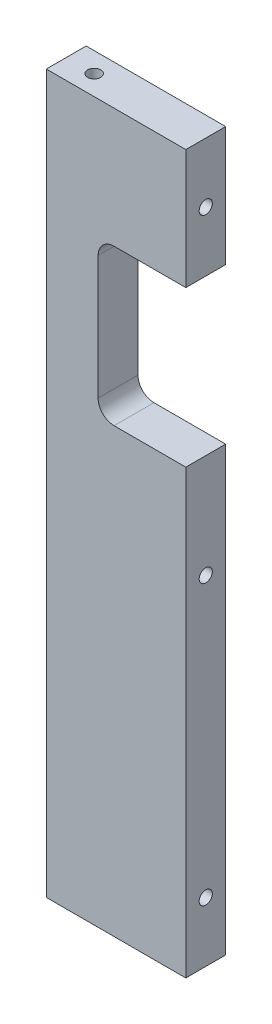
from build123d import *

# Parameters (mm, degrees)
SKETCH_1_W          = 35
SKETCH_1_H          = 180
EXTRUDE_1_DEPTH     = 10
SKETCH_2_W          = 22
SKETCH_2_H          = 39
CUT_EXTRUDE_1_DEPTH = 39
FILLET_1_R          = 4
SKETCH_3_R          = 1.65
CUT_EXTRUDE_2_DEPTH = 15
SKETCH_5_R          = 1.65
CUT_EXTRUDE_3_DEPTH = 15
SKETCH_6_R          = 1.139472941
SKETCH_6_R_2        = 1.207913295
CUT_EXTRUDE_4_DEPTH = 12
SKETCH_7_R          = 1.65
CUT_EXTRUDE_5_DEPTH = 12


with BuildPart() as part:
    # Эскиз1 → Бобышка-Вытянуть1 (new body)
    with BuildSketch(Plane.XY):
        with Locations((-10.704653715, -21.244958968)):
            Rectangle(SKETCH_1_W, SKETCH_1_H)
    extrude(amount=EXTRUDE_1_DEPTH)

    # Эскиз2 → Вырез-Вытянуть1 (cut)
    with BuildSketch(Plane(origin=(0, 0, 0), x_dir=(-1, 0, 0), z_dir=(0, 0, -1))):
        with Locations((4.204653715, 19.255041032)):
            Rectangle(SKETCH_2_W, SKETCH_2_H)
    extrude(amount=-CUT_EXTRUDE_1_DEPTH, mode=Mode.SUBTRACT)

    # Скругление1
    fillet_1_edges = [part.edges().sort_by_distance(p)[0] for p in [
        (-15.204653715, 38.755041032, 5),
        (-15.204653715, -0.244958968, 5),
    ]]
    fillet(fillet_1_edges, radius=FILLET_1_R)

    # Эскиз3 → Вырез-Вытянуть2 (cut)
    with BuildSketch(Plane.ZY.offset(28.204653715)):
        with Locations(Location((5, 38.651818595, 0), (0, 0, 270))):
            Circle(SKETCH_3_R)
        with Locations(Location((5, -21.348181405, 0), (0, 0, 270))):
            Circle(SKETCH_3_R)
        with Locations(Location((5, -81.348181405, 0), (0, 0, 270))):
            Circle(SKETCH_3_R)
    extrude(amount=-CUT_EXTRUDE_2_DEPTH, mode=Mode.SUBTRACT)

    # Эскиз5 → Вырез-Вытянуть3 (cut)
    with BuildSketch(Plane(origin=(6.795346285, 0, 0), x_dir=(0, 0, -1), z_dir=(1, 0, 0))):
        with Locations(Location((-5, 53.755041032, 0), (0, 0, 90))):
            Circle(SKETCH_5_R)
        with Locations(Location((-5, -26.244958968, 0), (0, 0, 90))):
            Circle(SKETCH_5_R)
        with Locations(Location((-5, -96.244958968, 0), (0, 0, 90))):
            Circle(SKETCH_5_R)
    extrude(amount=-CUT_EXTRUDE_3_DEPTH, mode=Mode.SUBTRACT)

    # Эскиз6 → Вырез-Вытянуть4 (cut)
    with BuildSketch(Plane.XZ.offset(111.244958968)):
        with Locations(Location((-22.204653715, 5, 0), (0, 0, 270))):
            Circle(SKETCH_6_R)
        with Locations(Location((-3.204653715, 5, 0), (0, 0, 270))):
            Circle(SKETCH_6_R_2)
    extrude(amount=-CUT_EXTRUDE_4_DEPTH, mode=Mode.SUBTRACT)

    # Эскиз7 → Вырез-Вытянуть5 (cut)
    with BuildSketch(Plane(origin=(0, 68.755041032, 0), x_dir=(1, 0, 0), z_dir=(0, 1, 0))):
        with Locations(Location((-21.204653715, -5, 0), (0, 0, 270))):
            Circle(SKETCH_7_R)
    extrude(amount=-CUT_EXTRUDE_5_DEPTH, mode=Mode.SUBTRACT)


solid = part.part
